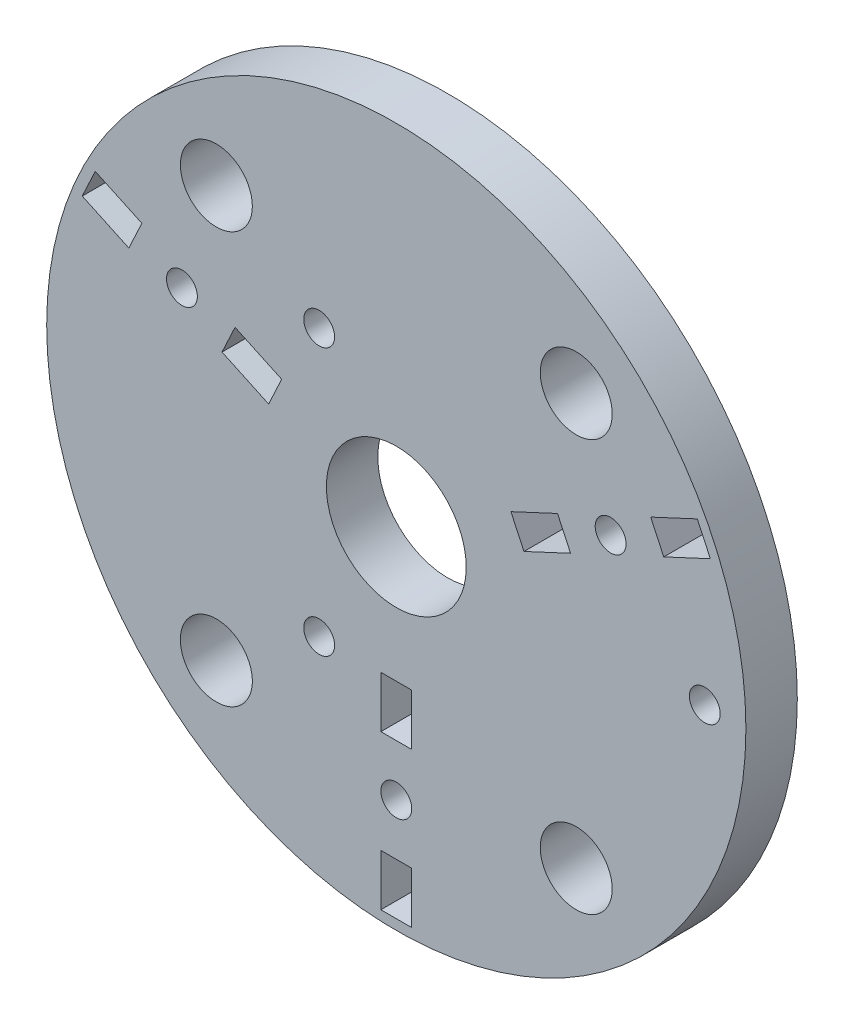
from build123d import *

# Parameters (mm, degrees)
SKETCH1_R           = 34
SKETCH1_R_2         = 1.5
SKETCH1_R_3         = 6.8
SKETCH1_R_4         = 3.5
SKETCH1_W           = 3
SKETCH1_H           = 5
BOSS_EXTRUDE1_DEPTH = 5


with BuildPart() as part:
    # Sketch1 → Boss-Extrude1 (new body)
    with BuildSketch(Plane.XY):
        Circle(SKETCH1_R)
        with Locations((30, 0)):
            Circle(SKETCH1_R_2, mode=Mode.SUBTRACT)
        with Locations((-7.5, -12.990381057)):
            Circle(SKETCH1_R_2, mode=Mode.SUBTRACT)
        with Locations((-7.5, 12.990381057)):
            Circle(SKETCH1_R_2, mode=Mode.SUBTRACT)
        Circle(SKETCH1_R_3, mode=Mode.SUBTRACT)
        with Locations((-17.5, 20)):
            Circle(SKETCH1_R_4, mode=Mode.SUBTRACT)
        with Locations(Location((17.5, 20, 0), (0, 0, 180))):
            Circle(SKETCH1_R_4, mode=Mode.SUBTRACT)
        with Locations(Location((-17.5, -20, 0), (0, 0, 180))):
            Circle(SKETCH1_R_4, mode=Mode.SUBTRACT)
        with Locations((17.5, -20)):
            Circle(SKETCH1_R_4, mode=Mode.SUBTRACT)
        with Locations((20.845079102, 9.72022002)):
            Circle(SKETCH1_R_2, mode=Mode.SUBTRACT)
        with Locations((-20.845079102, 9.72022002)):
            Circle(SKETCH1_R_2, mode=Mode.SUBTRACT)
        with Locations((0, -23)):
            Circle(SKETCH1_R_2, mode=Mode.SUBTRACT)
        Polygon((15.679612774, 8.966590392), (11.148073839, 6.853499083), (12.415928624, 4.134575722), (16.947467559, 6.247667031), align=None, mode=Mode.SUBTRACT)
        Polygon((24.742690644, 13.192773009), (29.27422958, 15.305864318), (30.542084365, 12.586940957), (26.01054543, 10.473849648), align=None, mode=Mode.SUBTRACT)
        Polygon((-16.947467559, 6.247667031), (-12.415928624, 4.134575722), (-11.148073839, 6.853499083), (-15.679612774, 8.966590392), align=None, mode=Mode.SUBTRACT)
        Polygon((-26.01054543, 10.473849648), (-30.542084365, 12.586940957), (-29.27422958, 15.305864318), (-24.742690644, 13.192773009), align=None, mode=Mode.SUBTRACT)
        with Locations((0, -30.5)):
            Rectangle(SKETCH1_W, SKETCH1_H, mode=Mode.SUBTRACT)
        with Locations((0, -15.5)):
            Rectangle(SKETCH1_W, SKETCH1_H, mode=Mode.SUBTRACT)
    extrude(amount=BOSS_EXTRUDE1_DEPTH)


solid = part.part
